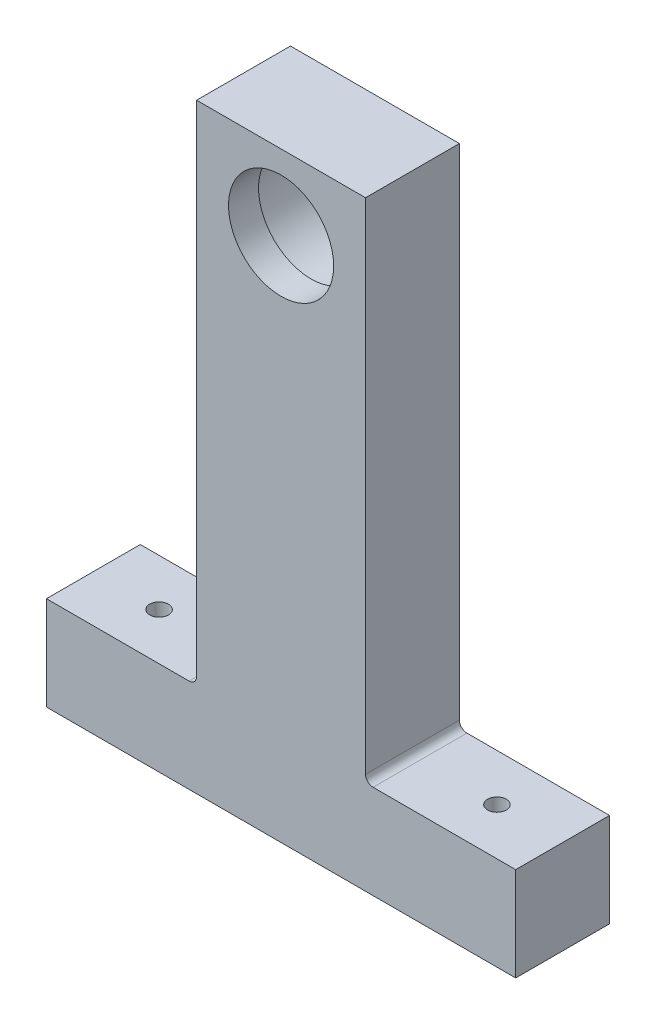
from build123d import *

# Parameters (mm, degrees)
SKETCH_1_R          = 16
EXTRUDE_1_DEPTH     = 25
FILLET_1_R          = 2
SKETCH_3_R          = 2.5
CUT_EXTRUDE_1_DEPTH = 30
EXTRUDE_START       = -8
SKETCH_4_R          = 16
SKETCH_4_R_2        = 14
EXTRUDE_2_DEPTH     = 8


with BuildPart() as part:
    # 草图1 → 凸台-拉伸1 (new body)
    with BuildSketch(Plane.XY):
        Polygon((-22.5, 50), (22.5, 50), (22.5, -85), (62.5, -85), (62.5, -110), (22.5, -110), (-22.5, -110), (-62.5, -110), (-62.5, -85), (-22.5, -85), align=None)
        with Locations((0, 30)):
            Circle(SKETCH_1_R, mode=Mode.SUBTRACT)
    extrude(amount=EXTRUDE_1_DEPTH)

    # 圆角1
    fillet_1_edges = [part.edges().sort_by_distance(p)[0] for p in [
        (-22.5, -85, 12.5),
        (22.5, -85, 12.5),
    ]]
    fillet(fillet_1_edges, radius=FILLET_1_R)

    # 草图3 → 切除-拉伸1 (cut)
    with BuildSketch(Plane(origin=(0, -85, 0), x_dir=(1, 0, 0), z_dir=(0, 1, 0))):
        with Locations(Location((-45, -12.5, 0), (0, 0, 270))):
            Circle(SKETCH_3_R)
        with Locations(Location((45, -12.5, 0), (0, 0, 270))):
            Circle(SKETCH_3_R)
    extrude(amount=-CUT_EXTRUDE_1_DEPTH, mode=Mode.SUBTRACT)

    # 草图4 → 凸台-拉伸2 (add)
    with BuildSketch(Plane.XY.offset(25).offset(EXTRUDE_START)):
        with Locations((0, 30)):
            Circle(SKETCH_4_R)
        with Locations((0, 30)):
            Circle(SKETCH_4_R_2, mode=Mode.SUBTRACT)
    extrude(amount=EXTRUDE_2_DEPTH)


solid = part.part
